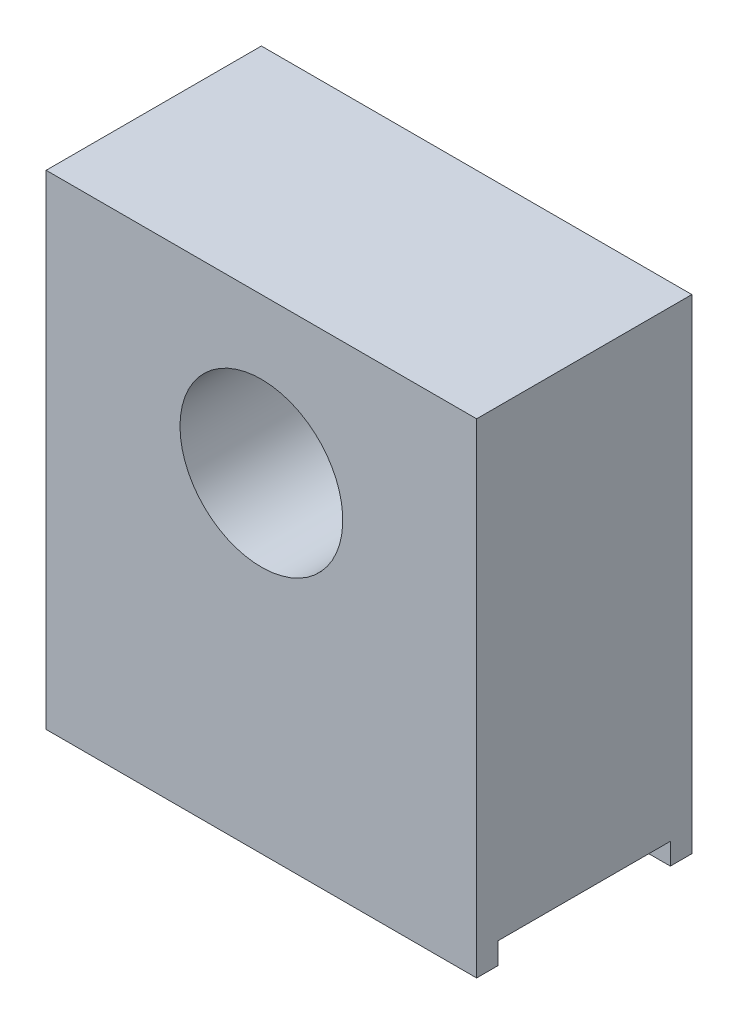
from build123d import *

# Parameters (mm, degrees)
SKETCH1_W           = 32
SKETCH1_H           = 16
BOSS_EXTRUDE1_DEPTH = 36
SKETCH2_W           = 32
SKETCH2_H           = 12.8
CUT_EXTRUDE1_DEPTH  = 1.6
SKETCH3_R           = 6.05
CUT_EXTRUDE2_DEPTH  = 44.036739415


with BuildPart() as part:
    # Sketch1 → Boss-Extrude1 (new body)
    with BuildSketch(Plane(origin=(0, 0, 0), x_dir=(1, 0, 0), z_dir=(0, 1, 0))):
        with Locations((1.325153374, -1.104294479)):
            Rectangle(SKETCH1_W, SKETCH1_H)
    extrude(amount=BOSS_EXTRUDE1_DEPTH)

    # Sketch2 → Cut-Extrude1 (cut)
    with BuildSketch(Plane(origin=(0, 0, 0), x_dir=(-1, 0, 0), z_dir=(0, -1, 0))):
        with Locations((-1.325153374, -1.104294479)):
            Rectangle(SKETCH2_W, SKETCH2_H)
    extrude(amount=-CUT_EXTRUDE1_DEPTH, mode=Mode.SUBTRACT)

    # Sketch3 → Cut-Extrude2 (cut, through all)
    with BuildSketch(Plane(origin=(0, 0, -6.895705521), x_dir=(-1, 0, 0), z_dir=(0, 0, -1))):
        with Locations((-1.325153374, 24.5)):
            Circle(SKETCH3_R)
    extrude(amount=-CUT_EXTRUDE2_DEPTH, mode=Mode.SUBTRACT)


solid = part.part
